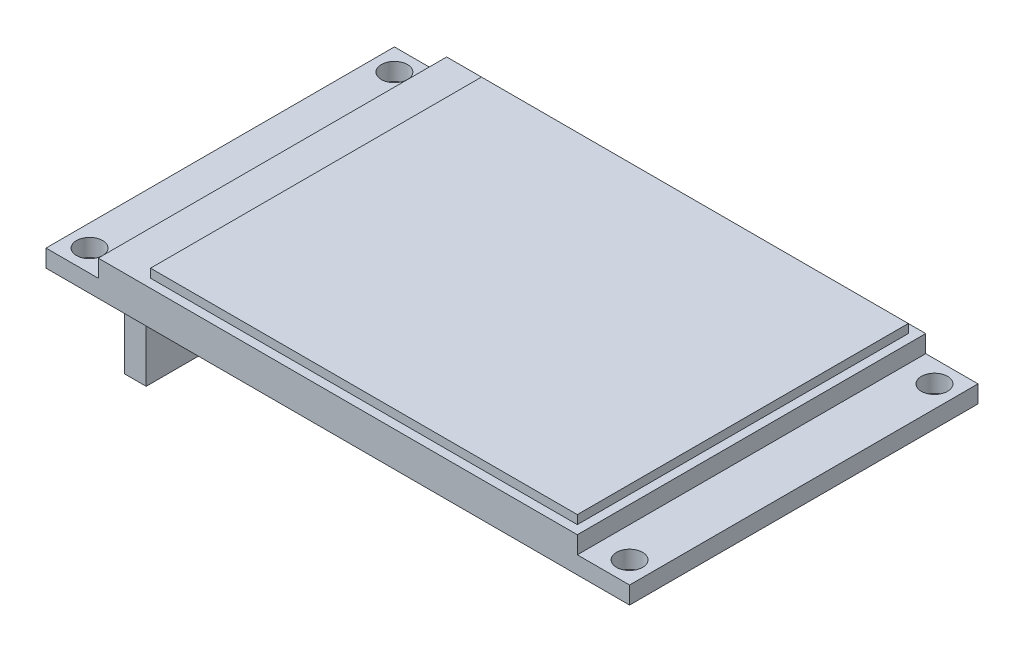
from build123d import *

# Parameters (mm, degrees)
SKETCH1_W           = 67
SKETCH1_H           = 40
BOSS_EXTRUDE1_DEPTH = 2
SKETCH2_W           = 55
SKETCH2_H           = 40
BOSS_EXTRUDE2_DEPTH = 2
SKETCH3_W           = 49
SKETCH3_H           = 38
BOSS_EXTRUDE4_DEPTH = 1
CUT_EXTRUDE1_REACH  = 80.09
SKETCH4_R           = 1.5
CUT_EXTRUDE2_REACH  = 80.09
SKETCH5_R           = 1.5
CUT_EXTRUDE3_REACH  = 80.09
SKETCH6_R           = 1.5
CUT_EXTRUDE4_REACH  = 80.09
SKETCH7_R           = 1.5
SKETCH9_W           = 2.5
SKETCH9_H           = 25
BOSS_EXTRUDE7_DEPTH = 15


with BuildPart() as part:
    # Sketch1 → Boss-Extrude1 (new body)
    with BuildSketch(Plane(origin=(0, 0, 0), x_dir=(1, 0, 0), z_dir=(0, 1, 0))):
        with Locations((33.5, 20)):
            Rectangle(SKETCH1_W, SKETCH1_H)
    extrude(amount=BOSS_EXTRUDE1_DEPTH)

    # Sketch2 → Boss-Extrude2 (add)
    with BuildSketch(Plane(origin=(0, 2, 0), x_dir=(1, 0, 0), z_dir=(0, 1, 0))):
        with Locations((33.5, 20)):
            Rectangle(SKETCH2_W, SKETCH2_H)
    extrude(amount=BOSS_EXTRUDE2_DEPTH)

    # Sketch3 → Boss-Extrude4 (add)
    with BuildSketch(Plane(origin=(0, 4, 0), x_dir=(1, 0, 0), z_dir=(0, 1, 0))):
        with Locations((35.5, 20)):
            Rectangle(SKETCH3_W, SKETCH3_H)
    extrude(amount=BOSS_EXTRUDE4_DEPTH)

    # Sketch4 → Cut-Extrude1 (cut, up to next)
    with BuildSketch(Plane(origin=(0, 2, 0), x_dir=(1, 0, 0), z_dir=(0, 1, 0)), mode=Mode.PRIVATE) as cut_extrude1_sk1:
        with Locations(Location((2.5, 37.5, 0), (0, 0, 270))):
            Circle(SKETCH4_R)
    cut_extrude1_tool1 = extrude(cut_extrude1_sk1.sketch, amount=-CUT_EXTRUDE1_REACH, mode=Mode.PRIVATE) & part.part
    add(cut_extrude1_tool1.solids().sort_by_distance((2.5, 2, -37.5))[0], mode=Mode.SUBTRACT)

    # Sketch5 → Cut-Extrude2 (cut, up to next)
    with BuildSketch(Plane(origin=(0, 2, 0), x_dir=(1, 0, 0), z_dir=(0, 1, 0)), mode=Mode.PRIVATE) as cut_extrude2_sk1:
        with Locations(Location((2.5, 2.5, 0), (0, 0, 270))):
            Circle(SKETCH5_R)
    cut_extrude2_tool1 = extrude(cut_extrude2_sk1.sketch, amount=-CUT_EXTRUDE2_REACH, mode=Mode.PRIVATE) & part.part
    add(cut_extrude2_tool1.solids().sort_by_distance((2.5, 2, -2.5))[0], mode=Mode.SUBTRACT)

    # Sketch6 → Cut-Extrude3 (cut, up to next)
    with BuildSketch(Plane(origin=(0, 2, 0), x_dir=(1, 0, 0), z_dir=(0, 1, 0)), mode=Mode.PRIVATE) as cut_extrude3_sk1:
        with Locations(Location((64.5, 37.5, 0), (0, 0, 270))):
            Circle(SKETCH6_R)
    cut_extrude3_tool1 = extrude(cut_extrude3_sk1.sketch, amount=-CUT_EXTRUDE3_REACH, mode=Mode.PRIVATE) & part.part
    add(cut_extrude3_tool1.solids().sort_by_distance((64.5, 2, -37.5))[0], mode=Mode.SUBTRACT)

    # Sketch7 → Cut-Extrude4 (cut, up to next)
    with BuildSketch(Plane(origin=(0, 2, 0), x_dir=(1, 0, 0), z_dir=(0, 1, 0)), mode=Mode.PRIVATE) as cut_extrude4_sk1:
        with Locations(Location((64.5, 2.5, 0), (0, 0, 270))):
            Circle(SKETCH7_R)
    cut_extrude4_tool1 = extrude(cut_extrude4_sk1.sketch, amount=-CUT_EXTRUDE4_REACH, mode=Mode.PRIVATE) & part.part
    add(cut_extrude4_tool1.solids().sort_by_distance((64.5, 2, -2.5))[0], mode=Mode.SUBTRACT)

    # Sketch9 → Boss-Extrude7 (add)
    with BuildSketch(Plane(origin=(0, 0, 0), x_dir=(-1, 0, 0), z_dir=(0, -1, 0))):
        with Locations((-1.25, 21.5)):
            Rectangle(SKETCH9_W, SKETCH9_H)
    extrude(amount=BOSS_EXTRUDE7_DEPTH)


solid = part.part
